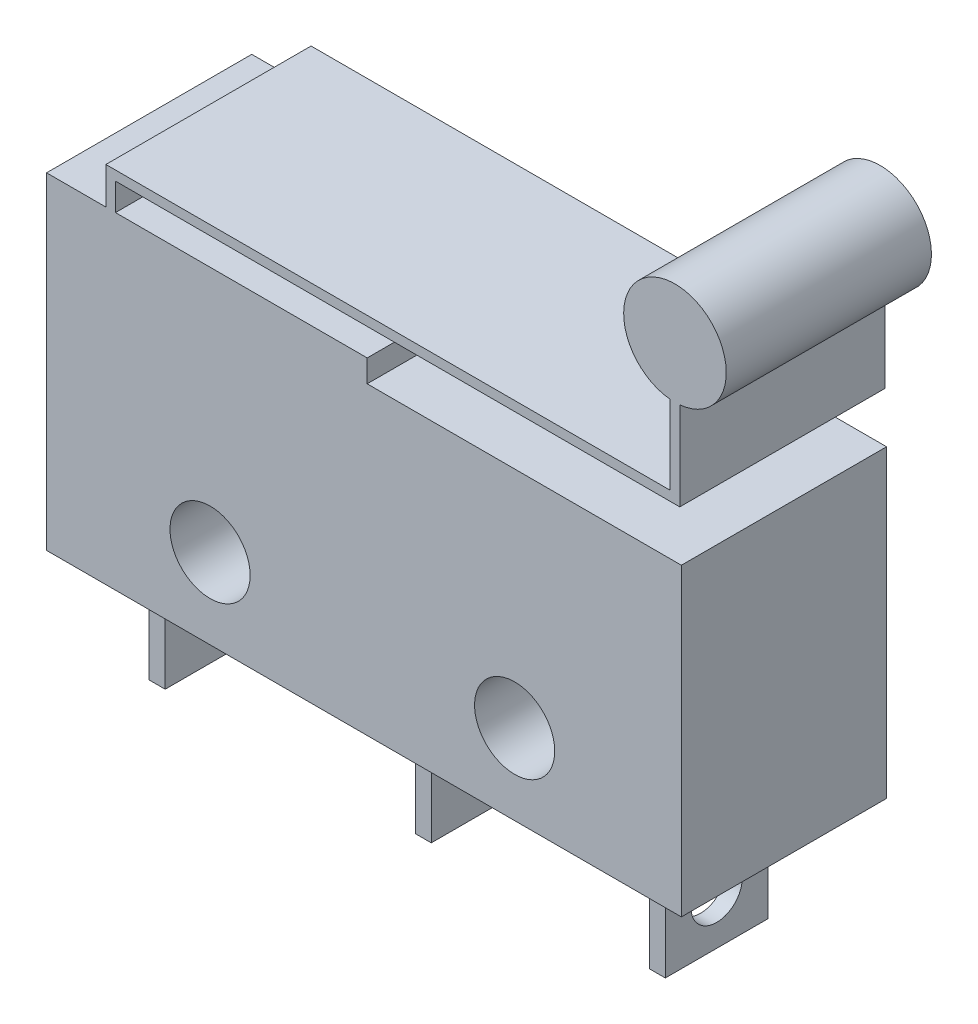
from build123d import *

# Parameters (mm, degrees)
SKETCH1_R           = 1.25
BOSS_EXTRUDE1_DEPTH = 6.4
SKETCH2_W           = 0.5
SKETCH2_H           = 3.2
BOSS_EXTRUDE2_DEPTH = 3.5
CUT_EXTRUDE1_REACH  = 27.362
SKETCH3_R           = 0.8


with BuildPart() as part:
    # Sketch1 → Boss-Extrude1 (new body)
    with BuildSketch(Plane.XY):
        with BuildLine():
            Line((0, 0), (19.8, 0))
            Line((19.8, 0), (19.8, 9.5))
            Line((19.8, 9.5), (10, 9.5))
            Line((10, 9.5), (10, 10.2))
            Line((10, 10.2), (2.15, 10.2))
            Line((2.15, 10.2), (2.15, 11.05))
            Line((2.15, 11.05), (19.75, 11.05))
            Line((19.75, 11.05), (19.75, 13.807046768))
            ThreePointArc((19.75, 13.807046768), (19.6, 17), (19.45, 13.807046768))
            Line((19.45, 13.807046768), (19.45, 11.35))
            Line((19.45, 11.35), (1.85, 11.35))
            Line((1.85, 11.35), (1.85, 10.2))
            Line((1.85, 10.2), (0, 10.2))
            Line((0, 10.2), (0, 4.415474079))
            Line((0, 4.415474079), (0, 0))
        make_face()
        with Locations((14.6, 2.5)):
            Circle(SKETCH1_R, mode=Mode.SUBTRACT)
        with Locations((5.1, 2.5)):
            Circle(SKETCH1_R, mode=Mode.SUBTRACT)
    extrude(amount=BOSS_EXTRUDE1_DEPTH)

    # Sketch2 → Boss-Extrude2 (add)
    with BuildSketch(Plane.XZ):
        with Locations((1.85, 3.2)):
            Rectangle(SKETCH2_W, SKETCH2_H)
        with Locations((10.15, 3.2)):
            Rectangle(SKETCH2_W, SKETCH2_H)
        with Locations((17.45, 3.2)):
            Rectangle(SKETCH2_W, SKETCH2_H)
    extrude(amount=BOSS_EXTRUDE2_DEPTH)

    # Cut-Extrude1: up to this face of the body (flat: up to its plane)
    cut_extrude1_end = Plane(part.part.faces().sort_by_distance((1.6, -1.75, 3.2))[0])
    # Sketch3 → Cut-Extrude1 (cut, up to the picked face)
    with BuildSketch(Plane(origin=(17.7, 0, 0), x_dir=(0, 0, -1), z_dir=(1, 0, 0)), mode=Mode.PRIVATE) as cut_extrude1_sk1:
        with Locations((-3.2, -2)):
            Circle(SKETCH3_R)
    cut_extrude1_tool1 = split(extrude(cut_extrude1_sk1.sketch, amount=-CUT_EXTRUDE1_REACH, mode=Mode.PRIVATE), bisect_by=cut_extrude1_end, keep=Keep.BOTH, mode=Mode.PRIVATE)
    add(cut_extrude1_tool1.solids().sort_by(Axis((17.7, -2, 3.2), (-1, 0, 0)))[0], mode=Mode.SUBTRACT)


solid = part.part
